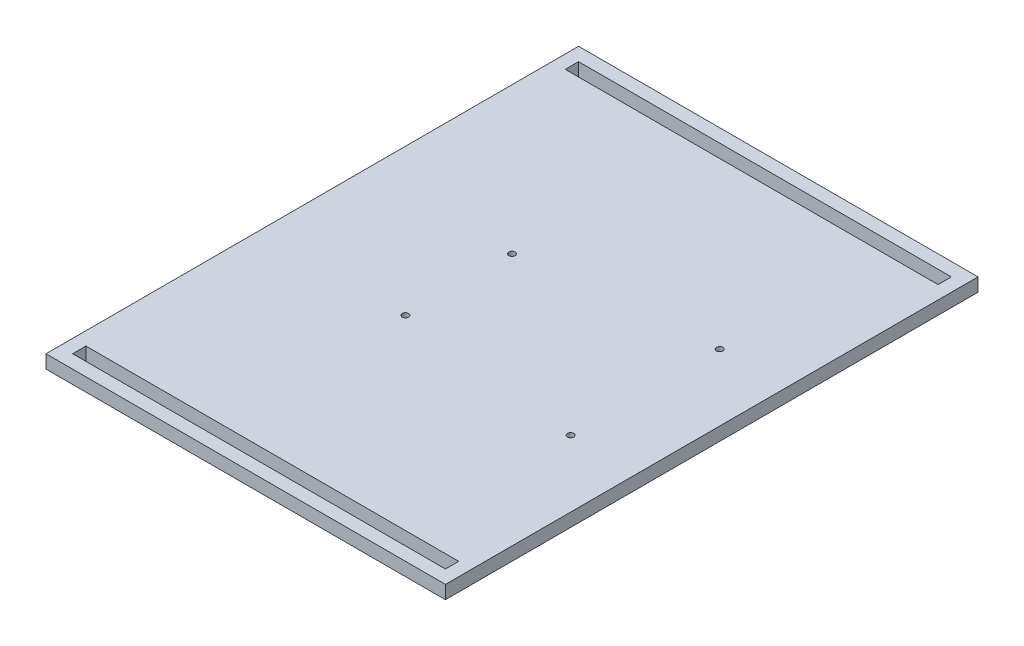
from build123d import *

# Parameters (mm, degrees)
SKETCH1_W           = 150
SKETCH1_H           = 200
BOSS_EXTRUDE1_DEPTH = 100
SHELL2_T            = -5
SKETCH5_R           = 1.9
CUT_EXTRUDE2_DEPTH  = 10
BOSS_EXTRUDE4_DEPTH = 200
SKETCH9_W           = 101.133931545
SKETCH9_H           = 31.996148617
CUT_EXTRUDE4_DEPTH  = 236.849528301
SKETCH10_R          = 4
CUT_EXTRUDE5_DEPTH  = 10
CUT_EXTRUDE7_REACH  = 162.078
SKETCH11_W          = 140
SKETCH11_H          = 5
SKETCH15_R          = 1.2
CUT_EXTRUDE11_DEPTH = 10
SKETCH36_W          = 60
SKETCH36_H          = 5
BOSS_EXTRUDE7_DEPTH = 10
SKETCH37_R          = 3.5
CUT_EXTRUDE15_DEPTH = 60
SKETCH38_R          = 5
CUT_EXTRUDE16_DEPTH = 70
SKETCH39_W          = 156.49295795
SKETCH39_H          = 102.702702005
CUT_EXTRUDE17_DEPTH = 236.849528301


with BuildPart() as part:
    # Sketch1 → Boss-Extrude1 (new body)
    with BuildSketch(Plane(origin=(0, 0, 0), x_dir=(1, 0, 0), z_dir=(0, 1, 0))):
        Rectangle(SKETCH1_W, SKETCH1_H)
    extrude(amount=BOSS_EXTRUDE1_DEPTH)

    # Shell2
    shell2_openings = [part.faces().sort_by_distance(p)[0] for p in [
        (0, 50, -100),
        (0, 50, 100),
    ]]
    offset(amount=SHELL2_T, openings=shell2_openings, kind=Kind.INTERSECTION)

    # Sketch5 → Cut-Extrude2 (cut)
    with BuildSketch(Plane.XZ):
        with Locations(Location((-65, 91, 0), (0, 0, 270))):
            Circle(SKETCH5_R)
        with Locations(Location((-35, 91, 0), (0, 0, 270))):
            Circle(SKETCH5_R)
        with Locations(Location((-65, 67, 0), (0, 0, 270))):
            Circle(SKETCH5_R)
        with Locations(Location((-35, 67, 0), (0, 0, 270))):
            Circle(SKETCH5_R)
    cut_extrude2 = extrude(amount=-CUT_EXTRUDE2_DEPTH, mode=Mode.SUBTRACT)

    # Mirror2: Cut-Extrude2 across plane
    add(cut_extrude2.mirror(Plane.XY), mode=Mode.SUBTRACT)

    # Sketch8 → Boss-Extrude4 (add, through all)
    with BuildSketch(Plane.XY.offset(100)):
        Polygon((-15, 17), (75, 17), (75, 22), (-20, 22), (-20, 0), (-15, 0), align=None)
    extrude(amount=-BOSS_EXTRUDE4_DEPTH)

    # Sketch9 → Cut-Extrude4 (cut, through all)
    with BuildSketch(Plane.XY.offset(100)):
        with Locations((35.566965773, 1.001925691)):
            Rectangle(SKETCH9_W, SKETCH9_H)
    extrude(amount=-CUT_EXTRUDE4_DEPTH, mode=Mode.SUBTRACT)

    # Sketch10 → Cut-Extrude5 (cut)
    with BuildSketch(Plane.XZ.offset(-17)):
        with Locations((60, 0)):
            Circle(SKETCH10_R)
    extrude(amount=-CUT_EXTRUDE5_DEPTH, mode=Mode.SUBTRACT)

    # Cut-Extrude7: up to this face of the body (flat: up to its plane)
    cut_extrude7_end = Plane(part.part.faces().sort_by_distance((-44.954220044, 5, 0))[0])
    # Sketch11 → Cut-Extrude7 (cut, up to the picked face)
    with BuildSketch(Plane(origin=(0, 100, 0), x_dir=(1, 0, 0), z_dir=(0, 1, 0)), mode=Mode.PRIVATE) as cut_extrude7_sk1:
        with Locations((0, -92.5)):
            Rectangle(SKETCH11_W, SKETCH11_H)
    cut_extrude7_tool1 = split(extrude(cut_extrude7_sk1.sketch, amount=-CUT_EXTRUDE7_REACH, mode=Mode.PRIVATE), bisect_by=cut_extrude7_end, keep=Keep.BOTH, mode=Mode.PRIVATE)
    cut_extrude7 = cut_extrude7_tool1.solids().sort_by(Axis((0, 100, 92.5), (0, -1, 0)))[0]
    add(cut_extrude7, mode=Mode.SUBTRACT)

    # Mirror3: Cut-Extrude7 across plane
    add(cut_extrude7.mirror(Plane.XY), mode=Mode.SUBTRACT)

    # Sketch15 → Cut-Extrude11 (cut)
    with BuildSketch(Plane(origin=(0, 100, 0), x_dir=(1, 0, 0), z_dir=(0, 1, 0))):
        with Locations(Location((50, 28, 0), (0, 0, 270))):
            Circle(SKETCH15_R)
        with Locations(Location((50, -28, 0), (0, 0, 270))):
            Circle(SKETCH15_R)
        with Locations(Location((-20, 20, 0), (0, 0, 270))):
            Circle(SKETCH15_R)
        with Locations(Location((-20, -20, 0), (0, 0, 270))):
            Circle(SKETCH15_R)
    extrude(amount=-CUT_EXTRUDE11_DEPTH, mode=Mode.SUBTRACT)

    # Sketch36 → Boss-Extrude7 (add)
    with BuildSketch(Plane.ZY.offset(-70)):
        with Locations((-13.202053215, 62.5)):
            Rectangle(SKETCH36_W, SKETCH36_H)
    boss_extrude7 = extrude(amount=BOSS_EXTRUDE7_DEPTH)

    # Mirror5: Boss-Extrude7 across plane
    add(boss_extrude7.mirror(Plane(origin=(0, 0, 0), x_dir=(0, 0, 1), z_dir=(1, 0, 0))))

    # Sketch37 → Cut-Extrude15 (cut)
    with BuildSketch(Plane(origin=(75, 0, 0), x_dir=(0, 0, -1), z_dir=(1, 0, 0))):
        with Locations((0, 75)):
            Circle(SKETCH37_R)
    extrude(amount=-CUT_EXTRUDE15_DEPTH, mode=Mode.SUBTRACT)

    # Sketch38 → Cut-Extrude16 (cut)
    with BuildSketch(Plane.ZY.offset(75)):
        with Locations((0, 80)):
            Circle(SKETCH38_R)
    extrude(amount=-CUT_EXTRUDE16_DEPTH, mode=Mode.SUBTRACT)

    # Sketch39 → Cut-Extrude17 (cut, through all)
    with BuildSketch(Plane.XY.offset(100)):
        with Locations((3.246478975, 43.648648997)):
            Rectangle(SKETCH39_W, SKETCH39_H)
    extrude(amount=-CUT_EXTRUDE17_DEPTH, mode=Mode.SUBTRACT)


solid = part.part
